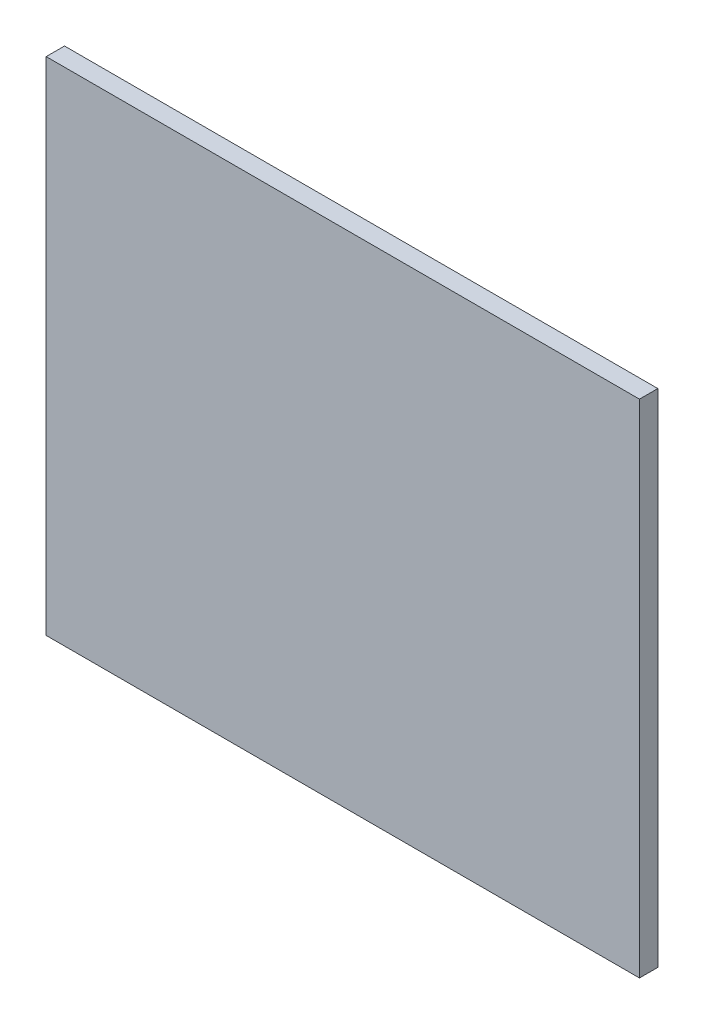
from build123d import *

# Parameters (mm, degrees)
ESQUISSE1_W        = 194
ESQUISSE1_H        = 163.92
BOSS_EXTRU_1_DEPTH = 6


with BuildPart() as part:
    # Esquisse1 → Boss.-Extru.1 (new body)
    with BuildSketch(Plane.XY):
        Rectangle(ESQUISSE1_W, ESQUISSE1_H)
    extrude(amount=BOSS_EXTRU_1_DEPTH)


solid = part.part
